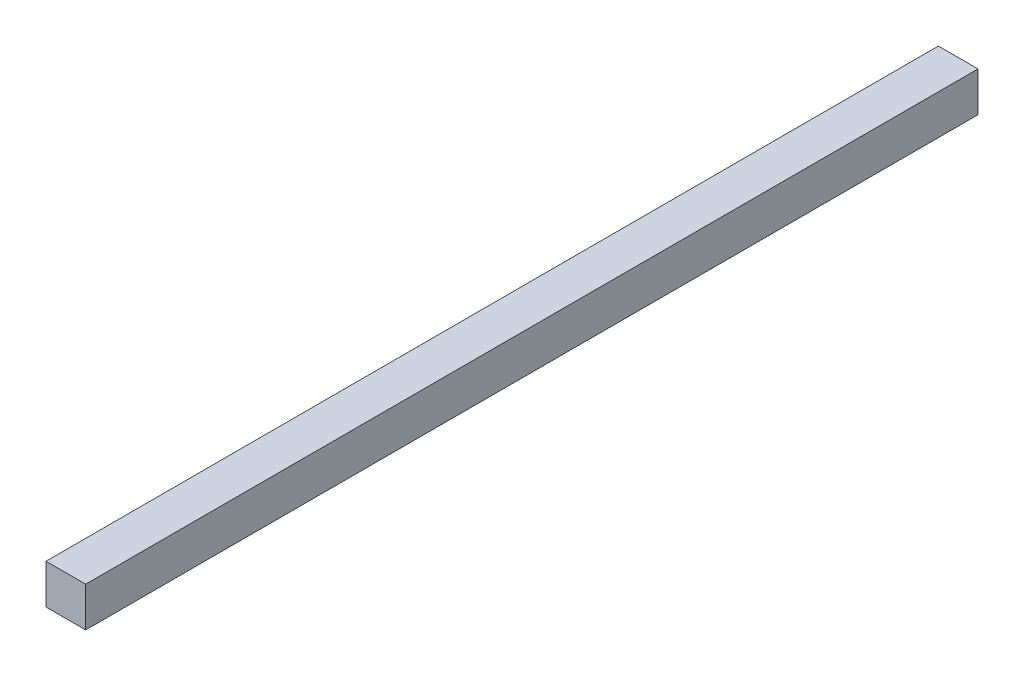
from build123d import *

# Parameters (mm, degrees)
SKETCH1_W           = 2.54
SKETCH1_H           = 2.54
BOSS_EXTRUDE1_DEPTH = 57.15


with BuildPart() as part:
    # Sketch1 → Boss-Extrude1 (new body)
    with BuildSketch(Plane.XY):
        with Locations((1.27, 1.27)):
            Rectangle(SKETCH1_W, SKETCH1_H)
    extrude(amount=BOSS_EXTRUDE1_DEPTH)


solid = part.part
